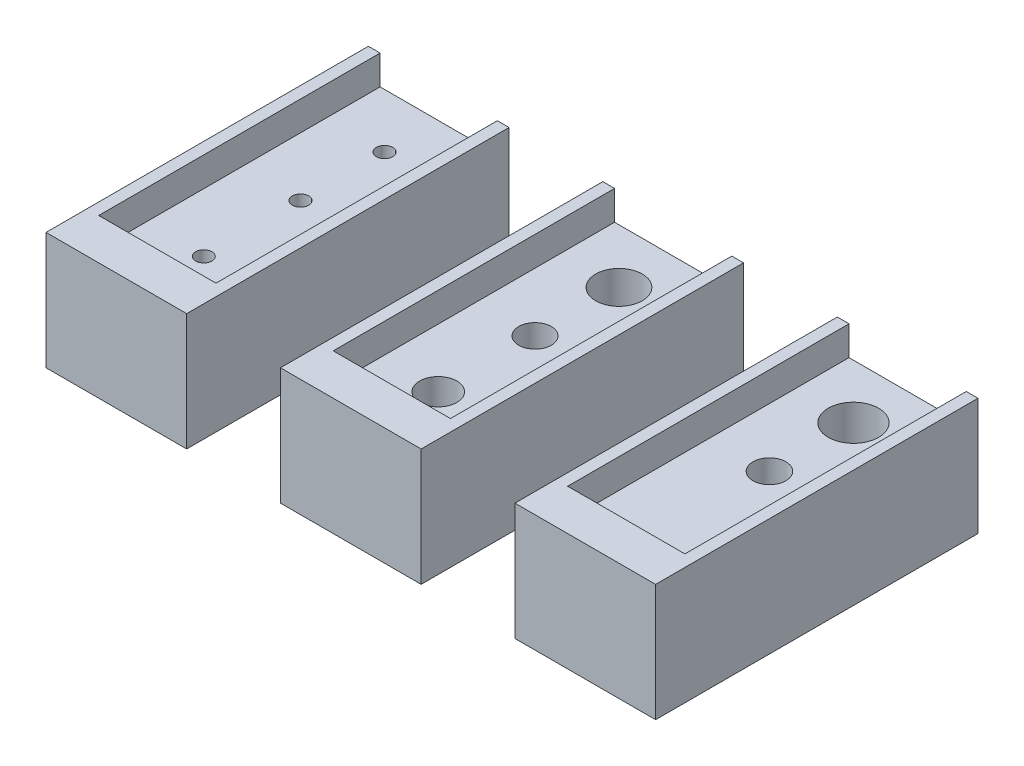
from build123d import *

# Parameters (mm, degrees)
SKETCH1_W             = 20
SKETCH1_H             = 55
BOSS_EXTRUDE1_DEPTH   = 15
BOSS_EXTRUDE1_2_DEPTH = 15
BOSS_EXTRUDE1_3_DEPTH = 15
SKETCH2_R             = 1.385
SKETCH2_R_2           = 4.3053
SKETCH2_R_3           = 2.8067
SKETCH2_R_4           = 3.175
SKETCH2_R_5           = 2.778125
SKETCH2_R_6           = 3.96875
CUT_EXTRUDE1_DEPTH    = 83.764726786
SKETCH3_W             = 20
SKETCH3_H             = 7
BOSS_EXTRUDE2_DEPTH   = 5
SKETCH4_W             = 2
SKETCH4_H             = 55
BOSS_EXTRUDE3_DEPTH   = 20


with BuildPart() as part:
    # Sketch1 → Boss-Extrude1 (new body)
    with BuildSketch(Plane(origin=(0, 0, 0), x_dir=(1, 0, 0), z_dir=(0, 1, 0))):
        with Locations((10, 27.5)):
            Rectangle(SKETCH1_W, SKETCH1_H)
    extrude(amount=BOSS_EXTRUDE1_DEPTH)


with BuildPart() as body_2:
    # Sketch1 → Boss-Extrude1 2 (new body)
    with BuildSketch(Plane(origin=(0, 0, 0), x_dir=(1, 0, 0), z_dir=(0, 1, 0))):
        with Locations((50, 27.5)):
            Rectangle(SKETCH1_W, SKETCH1_H)
    extrude(amount=BOSS_EXTRUDE1_2_DEPTH)


with BuildPart() as body_3:
    # Sketch1 → Boss-Extrude1 3 (new body)
    with BuildSketch(Plane(origin=(0, 0, 0), x_dir=(1, 0, 0), z_dir=(0, 1, 0))):
        with Locations((-30, 27.5)):
            Rectangle(SKETCH1_W, SKETCH1_H)
    extrude(amount=BOSS_EXTRUDE1_3_DEPTH)


with BuildPart() as cut_extrude1_tool:
    # Sketch2 → Cut-Extrude1 (new, through all)
    with BuildSketch(Plane(origin=(0, 15, 0), x_dir=(1, 0, 0), z_dir=(0, 1, 0))):
        with Locations(Location((-30, 45.75, 0), (0, 0, 270))):
            Circle(SKETCH2_R)
        with Locations(Location((-30, 31.42, 0), (0, 0, 270))):
            Circle(SKETCH2_R)
        with Locations(Location((-30, 14.92, 0), (0, 0, 270))):
            Circle(SKETCH2_R)
        with Locations(Location((50, 45.75, 0), (0, 0, 270))):
            Circle(SKETCH2_R_2)
        with Locations(Location((50, 31.42, 0), (0, 0, 270))):
            Circle(SKETCH2_R_3)
        with Locations(Location((10, 14.92, 0), (0, 0, 270))):
            Circle(SKETCH2_R_4)
        with Locations(Location((10, 31.42, 0), (0, 0, 270))):
            Circle(SKETCH2_R_5)
        with Locations(Location((10, 45.75, 0), (0, 0, 270))):
            Circle(SKETCH2_R_6)
    extrude(amount=-CUT_EXTRUDE1_DEPTH)


with BuildPart() as part_1:
    add(part.part)

    # Cut-Extrude1: cut by cut_extrude1_tool
    add(cut_extrude1_tool.part, mode=Mode.SUBTRACT)



with BuildPart() as body_2_1:
    add(body_2.part)

    # Cut-Extrude1: cut by cut_extrude1_tool
    add(cut_extrude1_tool.part, mode=Mode.SUBTRACT)


with BuildPart() as body_3_1:
    add(body_3.part)

    # Cut-Extrude1: cut by cut_extrude1_tool
    add(cut_extrude1_tool.part, mode=Mode.SUBTRACT)


with BuildPart() as part_2:
    add(part_1.part)

    add(body_2_1.part)  # Boss-Extrude2 merges body 2

    add(body_3_1.part)  # Boss-Extrude2 merges body 3
    # Sketch3 → Boss-Extrude2 (add)
    with BuildSketch(Plane(origin=(0, 15, 0), x_dir=(1, 0, 0), z_dir=(0, 1, 0))):
        with Locations((-30, 3.5)):
            Rectangle(SKETCH3_W, SKETCH3_H)
        with Locations((10, 3.5)):
            Rectangle(SKETCH3_W, SKETCH3_H)
        with Locations((50, 3.5)):
            Rectangle(SKETCH3_W, SKETCH3_H)
    extrude(amount=BOSS_EXTRUDE2_DEPTH)

    # Sketch4 → Boss-Extrude3 (add)
    with BuildSketch(Plane.XZ):
        with Locations((-41, -27.5)):
            Rectangle(SKETCH4_W, SKETCH4_H)
        with Locations((-19, -27.5)):
            Rectangle(SKETCH4_W, SKETCH4_H)
        with Locations((-1, -27.5)):
            Rectangle(SKETCH4_W, SKETCH4_H)
        with Locations((21, -27.5)):
            Rectangle(SKETCH4_W, SKETCH4_H)
        with Locations((39, -27.5)):
            Rectangle(SKETCH4_W, SKETCH4_H)
        with Locations((61, -27.5)):
            Rectangle(SKETCH4_W, SKETCH4_H)
    extrude(amount=-BOSS_EXTRUDE3_DEPTH)


solid = part_2.part
